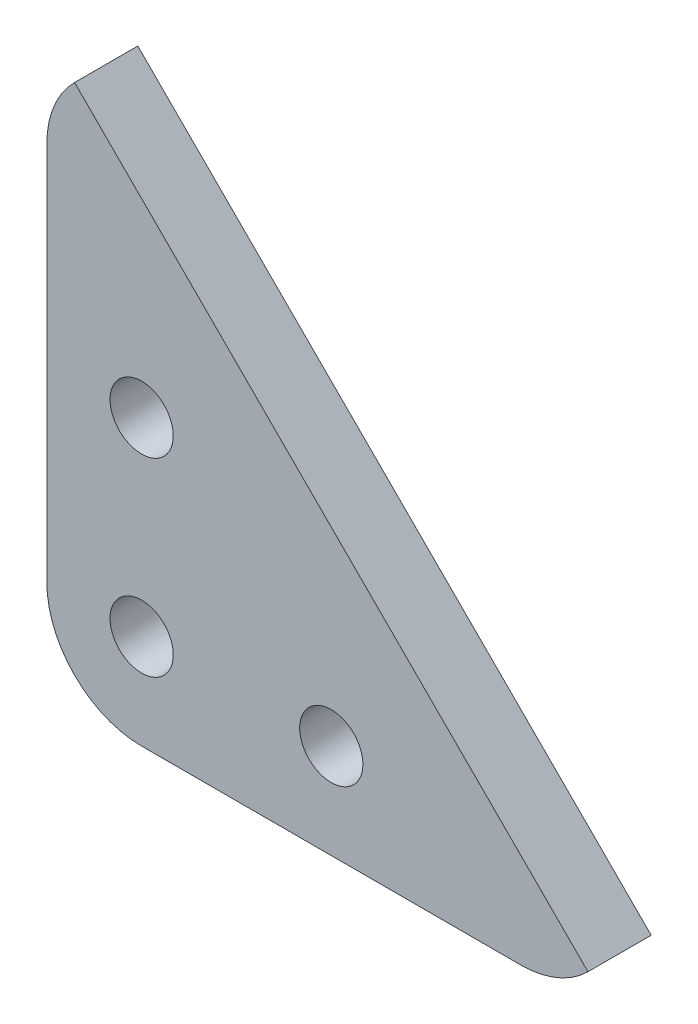
from build123d import *

# Parameters (mm, degrees)
MODEL_R                 = 1.5
SALIENTE_EXTRUIR1_DEPTH = 3


with BuildPart() as part:
    # Model → Saliente-Extruir1 (new body)
    with BuildSketch(Plane.XY):
        with BuildLine():
            Line((-105.943383637, 101.056539338), (-105.943383637, 83.056539338))
            ThreePointArc((-105.943383637, 83.056539338), (-104.625364152, 79.874558823), (-101.443383637, 78.556539338))
            Line((-101.443383637, 78.556539338), (-83.443383637, 78.556539338))
            ThreePointArc((-83.443383637, 78.556539338), (-81.721308191, 78.899081442), (-80.261403122, 79.874558823))
            Line((-80.261403122, 79.874558823), (-104.625364152, 104.238519853))
            ThreePointArc((-104.625364152, 104.238519853), (-105.600841533, 102.778614784), (-105.943383637, 101.056539338))
        make_face()
        with Locations((-101.443383637, 92.056539338)):
            Circle(MODEL_R, mode=Mode.SUBTRACT)
        with Locations((-101.443383637, 83.056539338)):
            Circle(MODEL_R, mode=Mode.SUBTRACT)
        with Locations((-92.443383637, 83.056539338)):
            Circle(MODEL_R, mode=Mode.SUBTRACT)
    extrude(amount=SALIENTE_EXTRUIR1_DEPTH)


solid = part.part
